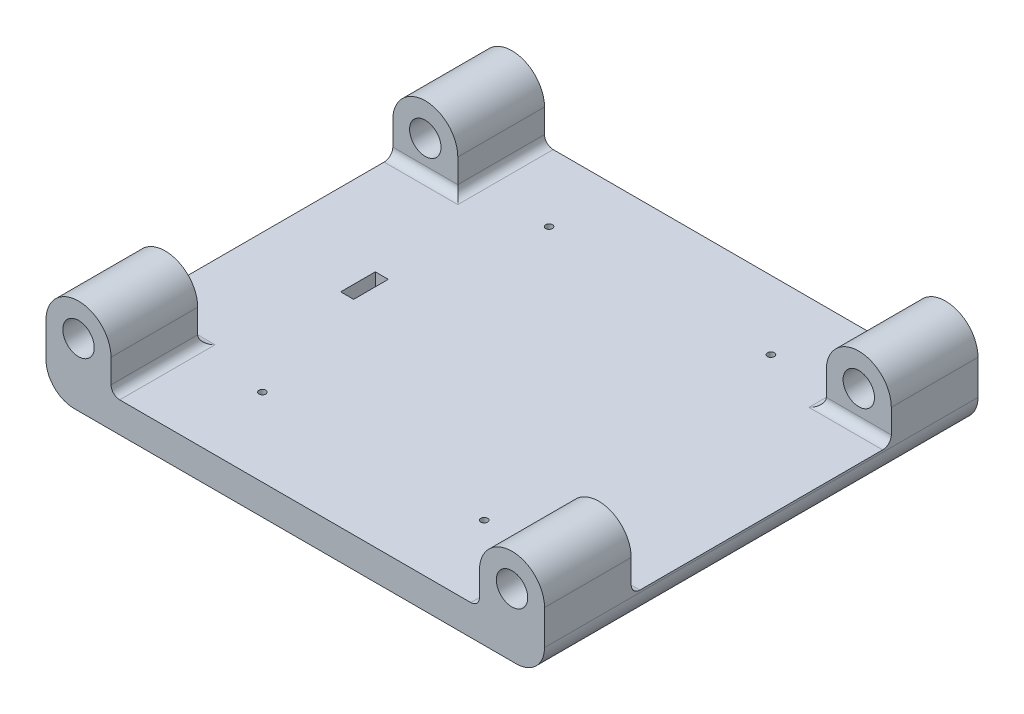
from build123d import *

# Parameters (mm, degrees)
SKETCH2_R           = 4.60375
BOSS_EXTRUDE1_DEPTH = 127
SKETCH3_W           = 76.2
SKETCH3_H           = 31.474420728
CUT_EXTRUDE1_DEPTH  = 254
FILLET1_R           = 2.54
FILLET2_R           = 2.54
FILLET3_R           = 2.54
FILLET4_R           = 2.54
SKETCH4_R           = 1
SKETCH4_W           = 3.81
SKETCH4_H           = 10.16
CUT_EXTRUDE2_DEPTH  = 254


with BuildPart() as part:
    # Sketch2 → Boss-Extrude1 (new body)
    with BuildSketch(Plane.XY):
        with BuildLine():
            Line((-25.661451909, -36.676833639), (-25.661451909, -43.661833639))
            ThreePointArc((-25.661451909, -43.661833639), (-24.917503133, -45.457884863), (-23.121451909, -46.201833639))
            Line((-23.121451909, -46.201833639), (79.748548091, -46.201833639))
            ThreePointArc((79.748548091, -46.201833639), (81.544599316, -45.457884863), (82.288548091, -43.661833639))
            Line((82.288548091, -43.661833639), (82.288548091, -36.676833639))
            ThreePointArc((82.288548091, -36.676833639), (91.813548091, -27.151833639), (101.338548091, -36.676833639))
            Line((101.338548091, -36.676833639), (101.338548091, -46.201833639))
            Line((101.338548091, -46.201833639), (101.338548091, -46.836833639))
            ThreePointArc((101.338548091, -46.836833639), (98.92071457, -52.674000118), (93.083548091, -55.091833639))
            Line((93.083548091, -55.091833639), (-36.456451909, -55.091833639))
            ThreePointArc((-36.456451909, -55.091833639), (-42.293618387, -52.674000118), (-44.711451909, -46.836833639))
            Line((-44.711451909, -46.836833639), (-44.711451909, -46.201833639))
            Line((-44.711451909, -46.201833639), (-44.711451909, -36.676833639))
            ThreePointArc((-44.711451909, -36.676833639), (-35.186451909, -27.151833639), (-25.661451909, -36.676833639))
        make_face()
        with Locations((-35.186451909, -36.676833639)):
            Circle(SKETCH2_R, mode=Mode.SUBTRACT)
        with Locations((91.813548091, -36.676833639)):
            Circle(SKETCH2_R, mode=Mode.SUBTRACT)
    extrude(amount=-BOSS_EXTRUDE1_DEPTH)

    # Sketch3 → Cut-Extrude1 (cut)
    with BuildSketch(Plane(origin=(101.338548091, 0, 0), x_dir=(0, 0, -1), z_dir=(1, 0, 0))):
        with Locations((63.5, -30.464623275)):
            Rectangle(SKETCH3_W, SKETCH3_H)
    extrude(amount=-CUT_EXTRUDE1_DEPTH, mode=Mode.SUBTRACT)

    # Fillet1
    fillet1_edges = [part.edges().sort_by_distance(p)[0] for p in [
        (-33.916451909, -46.201833639, -25.4),
    ]]
    fillet(fillet1_edges, radius=FILLET1_R)

    # Fillet2
    fillet2_edges = [part.edges().sort_by_distance(p)[0] for p in [
        (-33.916451909, -46.201833639, -101.6),
    ]]
    fillet(fillet2_edges, radius=FILLET2_R)

    # Fillet3
    fillet3_edges = [part.edges().sort_by_distance(p)[0] for p in [
        (90.543548091, -46.201833639, -101.6),
    ]]
    fillet(fillet3_edges, radius=FILLET3_R)

    # Fillet4
    fillet4_edges = [part.edges().sort_by_distance(p)[0] for p in [
        (90.543548091, -46.201833639, -25.4),
    ]]
    fillet(fillet4_edges, radius=FILLET4_R)

    # Sketch4 → Cut-Extrude2 (cut)
    with BuildSketch(Plane(origin=(0, -46.201833639, 0), x_dir=(1, 0, 0), z_dir=(0, 1, 0))):
        with Locations(Location((-4.185751909, 106.86, 0), (0, 0, 270))):
            Circle(SKETCH4_R)
        with Locations(Location((60.814248091, 106.86, 0), (0, 0, 270))):
            Circle(SKETCH4_R)
        with Locations(Location((-4.185751909, 22.86, 0), (0, 0, 270))):
            Circle(SKETCH4_R)
        with Locations(Location((60.814248091, 22.86, 0), (0, 0, 270))):
            Circle(SKETCH4_R)
        with Locations((-16.250739794, 64.844309946)):
            Rectangle(SKETCH4_W, SKETCH4_H)
    extrude(amount=-CUT_EXTRUDE2_DEPTH, mode=Mode.SUBTRACT)


solid = part.part
